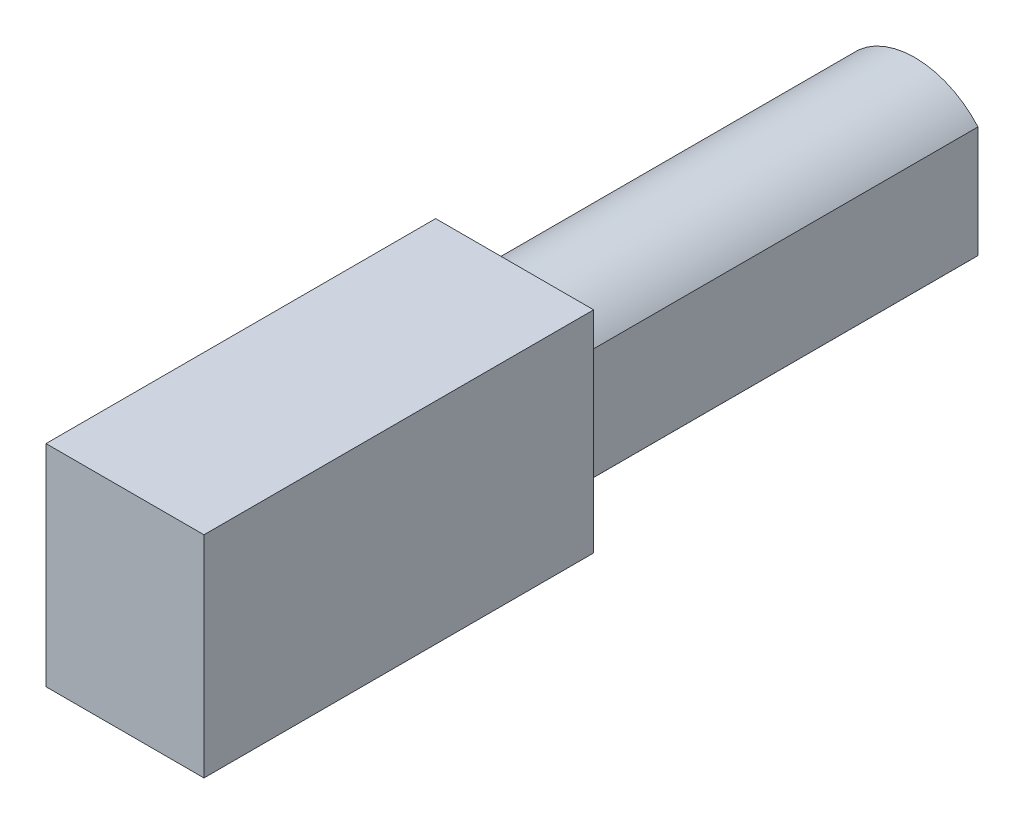
from build123d import *

# Parameters (mm, degrees)
BOSS_EXTRUDE1_DEPTH = 38
SKETCH2_W           = 15
SKETCH2_H           = 20
BOSS_EXTRUDE2_DEPTH = 37
SKETCH3_R           = 4.5
CUT_EXTRUDE1_DEPTH  = 30


with BuildPart() as part:
    # Sketch1 → Boss-Extrude1 (new body)
    with BuildSketch(Plane.XY):
        with BuildLine():
            Line((6, -5.291502622), (6, 5.291502622))
            ThreePointArc((6, 5.291502622), (0, 8), (-6, 5.291502622))
            Line((-6, 5.291502622), (-6, -5.291502622))
            ThreePointArc((-6, -5.291502622), (0, -8), (6, -5.291502622))
        make_face()
    extrude(amount=BOSS_EXTRUDE1_DEPTH)

    # Sketch2 → Boss-Extrude2 (add)
    with BuildSketch(Plane.XY.offset(38)):
        Rectangle(SKETCH2_W, SKETCH2_H)
    extrude(amount=BOSS_EXTRUDE2_DEPTH)

    # Sketch3 → Cut-Extrude1 (cut)
    with BuildSketch(Plane(origin=(0, 0, 0), x_dir=(-1, 0, 0), z_dir=(0, 0, -1))):
        Circle(SKETCH3_R)
    extrude(amount=-CUT_EXTRUDE1_DEPTH, mode=Mode.SUBTRACT)


solid = part.part
